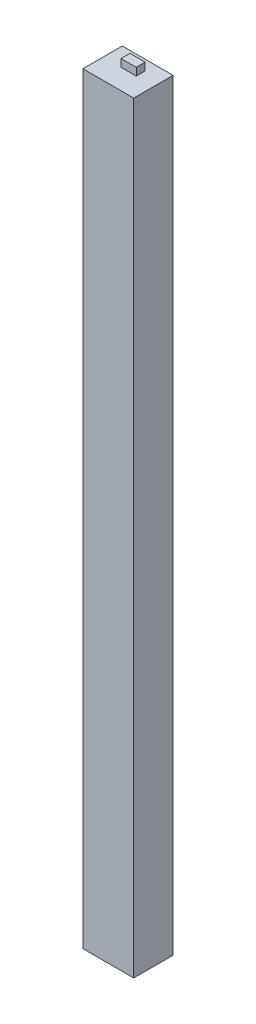
from build123d import *

# Parameters (mm, degrees)
SKETCH_1_W        = 20
SKETCH_1_H        = 300
EXTRUDE_253_DEPTH = 15.5
SKETCH_2_W        = 6
SKETCH_2_H        = 3.5
EXTRUDE_491_DEPTH = 3


with BuildPart() as part:
    # 草图1 → Extrude 253 (new body)
    with BuildSketch(Plane.XY):
        Rectangle(SKETCH_1_W, SKETCH_1_H)
    extrude(amount=EXTRUDE_253_DEPTH)

    # 草图2 → Extrude 491 (add)
    with BuildSketch(Plane(origin=(0, 150, 0), x_dir=(1, 0, 0), z_dir=(0, 1, 0))):
        with Locations((0, -5.75)):
            Rectangle(SKETCH_2_W, SKETCH_2_H)
    extrude(amount=EXTRUDE_491_DEPTH)


solid = part.part
